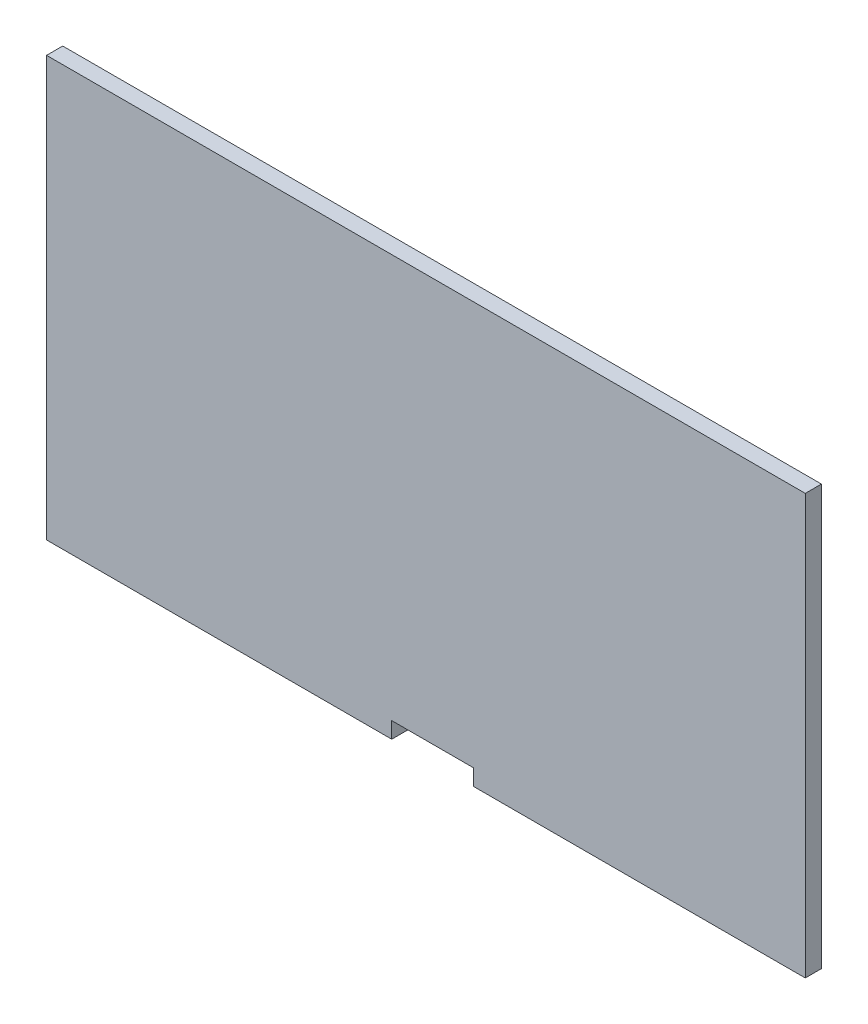
from build123d import *

# Parameters (mm, degrees)
BOSS_EXTRUDE1_DEPTH = 1
SKETCH2_W           = 45
SKETCH2_H           = 24
BOSS_EXTRUDE2_DEPTH = 2


with BuildPart() as part:
    # Sketch1 → Boss-Extrude1 (new body)
    with BuildSketch(Plane.XY.offset(40.959042005)):
        Polygon((16.495104543, 13.703029386), (-3.886901765, 13.703029386), (-3.886901765, 37.703029386), (41.113098235, 37.703029386), (41.113098235, 13.703029386), (21.556960057, 13.703029386), (21.556960057, 12.703029386), (42.113098235, 12.703029386), (42.113098235, 38.703029386), (-4.886901765, 38.703029386), (-4.886901765, 12.703029386), (16.495104543, 12.703029386), align=None)
    extrude(amount=BOSS_EXTRUDE1_DEPTH)

    # Sketch2 → Boss-Extrude2 (add)
    with BuildSketch(Plane.XY.offset(41.959042005)):
        with Locations((18.613098235, 25.703029386)):
            Rectangle(SKETCH2_W, SKETCH2_H)
    extrude(amount=-BOSS_EXTRUDE2_DEPTH)


solid = part.part
